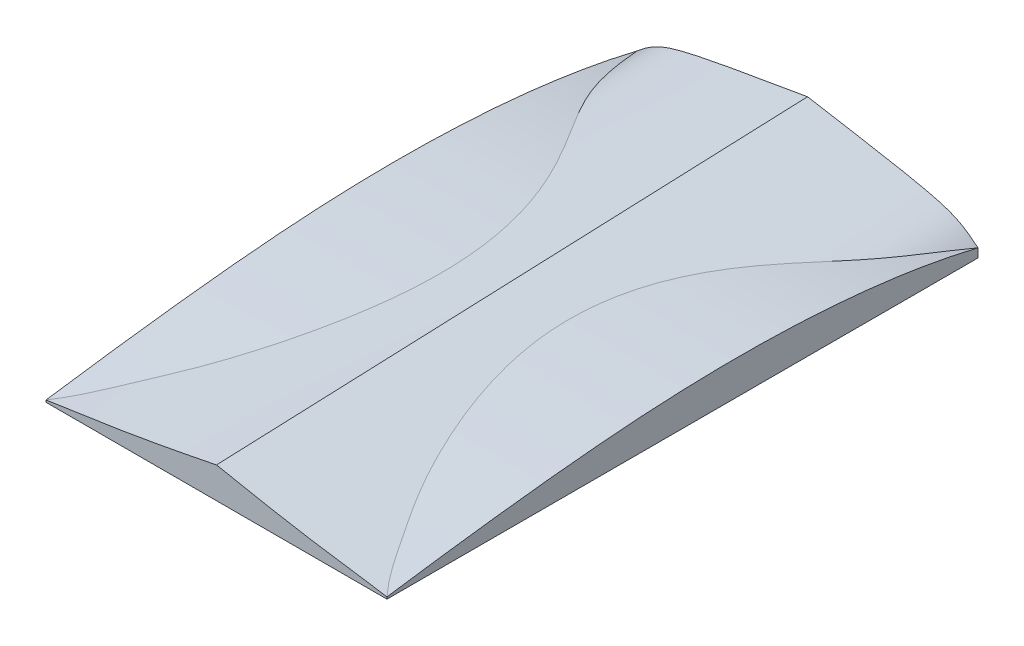
from build123d import *

# Parameters (mm, degrees)
SKETCH1_W           = 75
SKETCH1_H           = 130
BOSS_EXTRUDE1_DEPTH = 10


with BuildPart() as part:
    # Sketch1 → Boss-Extrude1 (new, symmetric)
    with BuildSketch(Plane(origin=(0, 0, 0), x_dir=(1, 0, 0), z_dir=(0, 1, 0))):
        Rectangle(SKETCH1_W, SKETCH1_H)
    extrude(amount=BOSS_EXTRUDE1_DEPTH, both=True)

    # Sketch18 → Cut-Loft2 section 0
    with BuildSketch(Plane(origin=(0, 0, -65), x_dir=(-1, 0, 0), z_dir=(0, 0, -1))):
        with BuildLine():
            Line((-37.5, -8.067205879), (-37.5, 10))
            Line((-37.5, 10), (37.5, 10))
            Line((37.5, 10), (37.5, -8.067205879))
            add(Edge.make_bspline(
                [(37.5, -8.067205879), (36.868354158, -7.545723818), (36.232515665, -7.031356123), (34.9150412, -6.080332922), (34.231976939, -5.64610103), (32.799590286, -4.890068418), (32.051510087, -4.566159862), (30.894312176, -4.139819038), (30.50255078, -4.007063364), (29.718003297, -3.757880572), (29.324173778, -3.641189654), (28.139305681, -3.308278708), (27.345030939, -3.108492419), (25.751942464, -2.731969529), (24.953040234, -2.555682332), (22.552383626, -2.046879016), (20.946741679, -1.73410457), (16.124007748, -0.825275602), (12.901013123, -0.259195592), (6.452423939, 0.859761572), (3.226270152, 1.409798881), (0, 1.959245267)],
                knots=[0, 0, 0, 0, 0.0625, 0.0625, 0.125, 0.125, 0.1875, 0.1875, 0.21875, 0.21875, 0.25, 0.25, 0.3125, 0.3125, 0.375, 0.375, 0.5, 0.5, 0.75, 0.75, 1, 1, 1, 1], degree=3))
            add(Edge.make_bspline(
                [(0, 1.959245267), (-3.220307336, 1.410814372), (-6.440507139, 0.86179111), (-12.877490243, -0.255075859), (-16.09478496, -0.820102332), (-20.909950392, -1.727007192), (-22.513230185, -2.03908866), (-24.911012133, -2.546530452), (-25.709493997, -2.722427014), (-27.298060456, -3.096927844), (-28.088557635, -3.29521287), (-29.655363733, -3.733135251), (-30.431632803, -3.972888742), (-31.958036808, -4.528564833), (-32.707328207, -4.846945958), (-33.799969506, -5.415730657), (-34.159815247, -5.621350704), (-34.864751883, -6.060575044), (-35.207986102, -6.292686311), (-36.216294341, -7.017979177), (-36.860577231, -7.539303245), (-37.5, -8.067205879)],
                knots=[0, 0, 0, 0, 0.25, 0.25, 0.5, 0.5, 0.625, 0.625, 0.6875, 0.6875, 0.75, 0.75, 0.8125, 0.8125, 0.875, 0.875, 0.90625, 0.90625, 0.9375, 0.9375, 1, 1, 1, 1], degree=3))
        make_face()
    # Sketch19 → Cut-Loft2 section 1
    with BuildSketch(Plane.XY.offset(65)):
        with BuildLine():
            Line((-37.5, -9.55282328), (-37.5, 10))
            Line((-37.5, 10), (37.5, 10))
            Line((37.5, 10), (37.5, -9.55282328))
            add(Edge.make_bspline(
                [(37.5, -9.55282328), (35.932013067, -9.320012995), (34.36408728, -9.086801305), (31.231041127, -8.601961383), (29.664529784, -8.359464397), (26.527308392, -7.902033368), (24.957345427, -7.682195005), (21.822950757, -7.206207592), (20.258104881, -6.952769992), (15.568704339, -6.158778808), (12.449953925, -5.589410309), (6.219567493, -4.412774878), (3.108245531, -3.803834972), (0, -3.178506899)],
                knots=[0, 0, 0, 0, 0.125, 0.125, 0.25, 0.25, 0.375, 0.375, 0.5, 0.5, 0.75, 0.75, 1, 1, 1, 1], degree=3))
            add(Edge.make_bspline(
                [(0, -3.178506899), (-3.10824669, -3.803835204), (-6.21957007, -4.412775385), (-12.449959995, -5.589411435), (-15.568715473, -6.158780795), (-20.258115527, -6.952771743), (-21.822959191, -7.206208919), (-24.957352089, -7.68219597), (-26.527314428, -7.902034226), (-29.664534297, -8.359465077), (-31.231044679, -8.601961938), (-34.364088921, -9.086801553), (-35.932013884, -9.320013117), (-37.5, -9.55282328)],
                knots=[0, 0, 0, 0, 0.25, 0.25, 0.5, 0.5, 0.625, 0.625, 0.75, 0.75, 0.875, 0.875, 1, 1, 1, 1], degree=3))
        make_face()
    loft(mode=Mode.SUBTRACT)

    # Sketch22 → Loft1 section 0
    with BuildSketch(Plane(origin=(37.5, 0, 0), x_dir=(0, 0, -1), z_dir=(1, 0, 0))):
        with BuildLine():
            Line((-65, -9.55282328), (-65, -10))
            Line((-65, -10), (65, -10))
            Line((65, -10), (65, -8.067205879))
            add(Edge.make_bspline(
                [(65, -8.067205879), (59.66858748, -6.779803174), (54.307105316, -5.768751628), (43.536931445, -4.180521721), (38.128214021, -3.603579704), (27.272426373, -2.802172102), (21.82546577, -2.576699058), (13.630427287, -2.464550347), (10.894685054, -2.46523815), (5.434548965, -2.537160266), (2.707640474, -2.608230068), (-5.464184608, -2.920340072), (-10.899890277, -3.263731439), (-21.75289667, -4.155028741), (-27.170549339, -4.699023884), (-37.99465892, -5.911420694), (-43.400914096, -6.582064044), (-54.205711181, -8.009060079), (-59.604185655, -8.766162086), (-65, -9.55282328)],
                knots=[0, 0, 0, 0, 0.125, 0.125, 0.25, 0.25, 0.375, 0.375, 0.4375, 0.4375, 0.5, 0.5, 0.625, 0.625, 0.75, 0.75, 0.875, 0.875, 1, 1, 1, 1], degree=3))
        make_face()
    # Sketch21 → Loft1 section 1
    with BuildSketch(Plane.ZY.offset(37.5)):
        with BuildLine():
            Line((-65, -8.067205879), (-65, -10))
            Line((-65, -10), (65, -10))
            Line((65, -10), (65, -9.55282328))
            add(Edge.make_bspline(
                [(-65, -8.067205879), (-59.66858748, -6.779803174), (-54.307105316, -5.768751628), (-43.536931445, -4.180521721), (-38.128214021, -3.603579704), (-27.272426373, -2.802172102), (-21.82546577, -2.576699058), (-13.630427287, -2.464550347), (-10.894685054, -2.46523815), (-5.434548965, -2.537160266), (-2.707640474, -2.608230068), (5.464184608, -2.920340072), (10.899890277, -3.263731439), (21.75289667, -4.155028741), (27.170549339, -4.699023884), (37.99465892, -5.911420694), (43.400914096, -6.582064044), (54.205711181, -8.009060079), (59.604185655, -8.766162086), (65, -9.55282328)],
                knots=[0, 0, 0, 0, 0.125, 0.125, 0.25, 0.25, 0.375, 0.375, 0.4375, 0.4375, 0.5, 0.5, 0.625, 0.625, 0.75, 0.75, 0.875, 0.875, 1, 1, 1, 1], degree=3))
        make_face()
    loft()


solid = part.part
